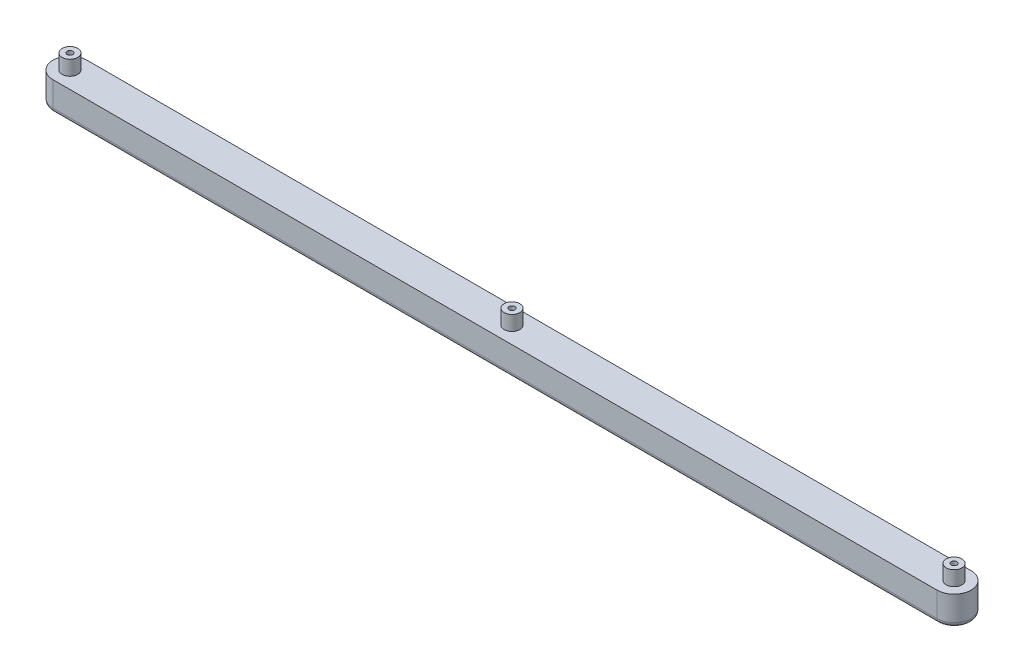
from build123d import *

# Parameters (mm, degrees)
SALIENTE_EXTRUIR1_DEPTH = 3
CROQUIS3_R              = 1.59
SALIENTE_EXTRUIR2_DEPTH = 3
REDONDEO1_R             = 1
CROQUIS4_R              = 0.59
CORTAR_EXTRUIR1_DEPTH   = 94.945755625


with BuildPart() as part:
    # Croquis2 → Saliente-Extruir1 (new, symmetric)
    with BuildSketch(Plane(origin=(0, 0, 0), x_dir=(1, 0, 0), z_dir=(0, 1, 0))):
        with BuildLine():
            Line((-90, -3.45), (90, -3.45))
            ThreePointArc((90, -3.45), (93.45, 0), (90, 3.45))
            Line((90, 3.45), (-90, 3.45))
            ThreePointArc((-90, 3.45), (-93.45, 0), (-90, -3.45))
        make_face()
    extrude(amount=SALIENTE_EXTRUIR1_DEPTH, both=True)

    # Croquis3 → Saliente-Extruir2 (add)
    with BuildSketch(Plane(origin=(0, 3, 0), x_dir=(1, 0, 0), z_dir=(0, 1, 0))):
        with Locations(Location((-90, 0, 0), (0, 0, 270))):
            Circle(CROQUIS3_R)
        with Locations(Location((90, 0, 0), (0, 0, 270))):
            Circle(CROQUIS3_R)
        with Locations(Location((0, 0, 0), (0, 0, 270))):
            Circle(CROQUIS3_R)
    extrude(amount=SALIENTE_EXTRUIR2_DEPTH)

    # Redondeo1
    redondeo1_edges = [part.edges().sort_by_distance(p)[0] for p in [
        (0, -3, -3.45),
        (93.45, -3, 0),
        (0, -3, 3.45),
        (-93.45, -3, 0),
    ]]
    fillet(redondeo1_edges, radius=REDONDEO1_R)

    # Croquis4 → Cortar-Extruir1 (cut, through all)
    with BuildSketch(Plane(origin=(0, 6, 0), x_dir=(1, 0, 0), z_dir=(0, 1, 0))):
        with Locations(Location((90, 0, 0), (0, 0, 270))):
            Circle(CROQUIS4_R)
        with Locations(Location((-90, 0, 0), (0, 0, 270))):
            Circle(CROQUIS4_R)
        with Locations(Location((0, 0, 0), (0, 0, 270))):
            Circle(CROQUIS4_R)
    extrude(amount=-CORTAR_EXTRUIR1_DEPTH, mode=Mode.SUBTRACT)


solid = part.part
